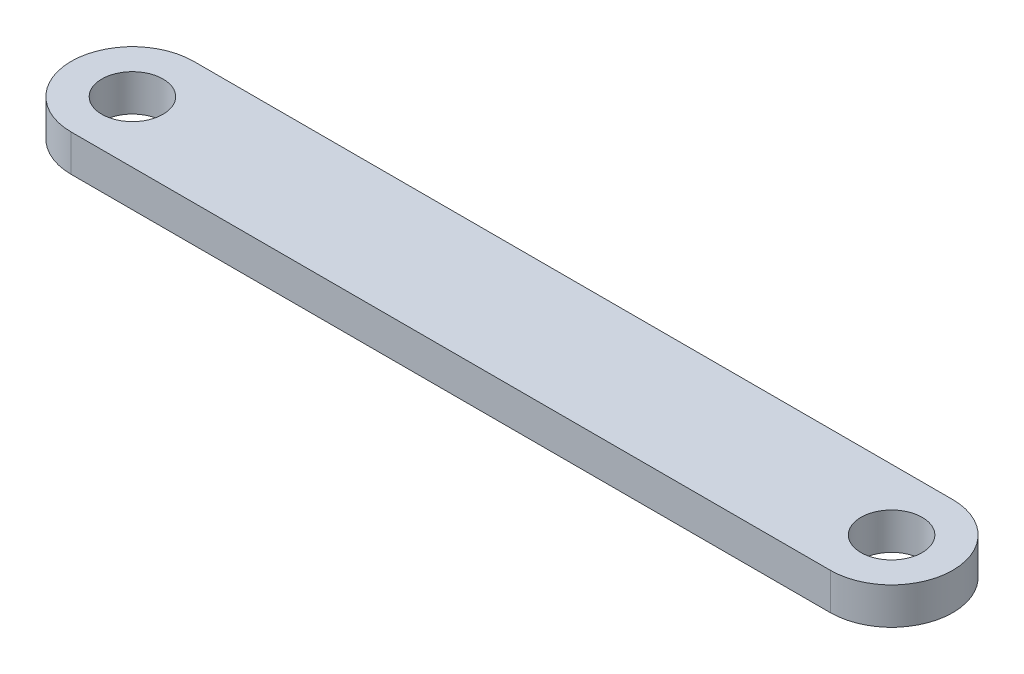
from build123d import *

# Parameters (mm, degrees)
SKETCH1_R           = 3.175
BOSS_EXTRUDE1_DEPTH = 3.81


with BuildPart() as part:
    # Sketch1 → Boss-Extrude1 (new body)
    with BuildSketch(Plane(origin=(0, 0, 0), x_dir=(1, 0, 0), z_dir=(0, 1, 0))):
        with BuildLine():
            Line((-39.37, 6.35), (39.37, 6.35))
            ThreePointArc((39.37, 6.35), (45.72, 0), (39.37, -6.35))
            Line((39.37, -6.35), (-39.37, -6.35))
            ThreePointArc((-39.37, -6.35), (-45.72, 0), (-39.37, 6.35))
        make_face()
        with Locations(Location((-39.37, 0, 0), (0, 0, 90))):
            Circle(SKETCH1_R, mode=Mode.SUBTRACT)
        with Locations(Location((39.37, 0, 0), (0, 0, 90))):
            Circle(SKETCH1_R, mode=Mode.SUBTRACT)
    extrude(amount=BOSS_EXTRUDE1_DEPTH)


solid = part.part
